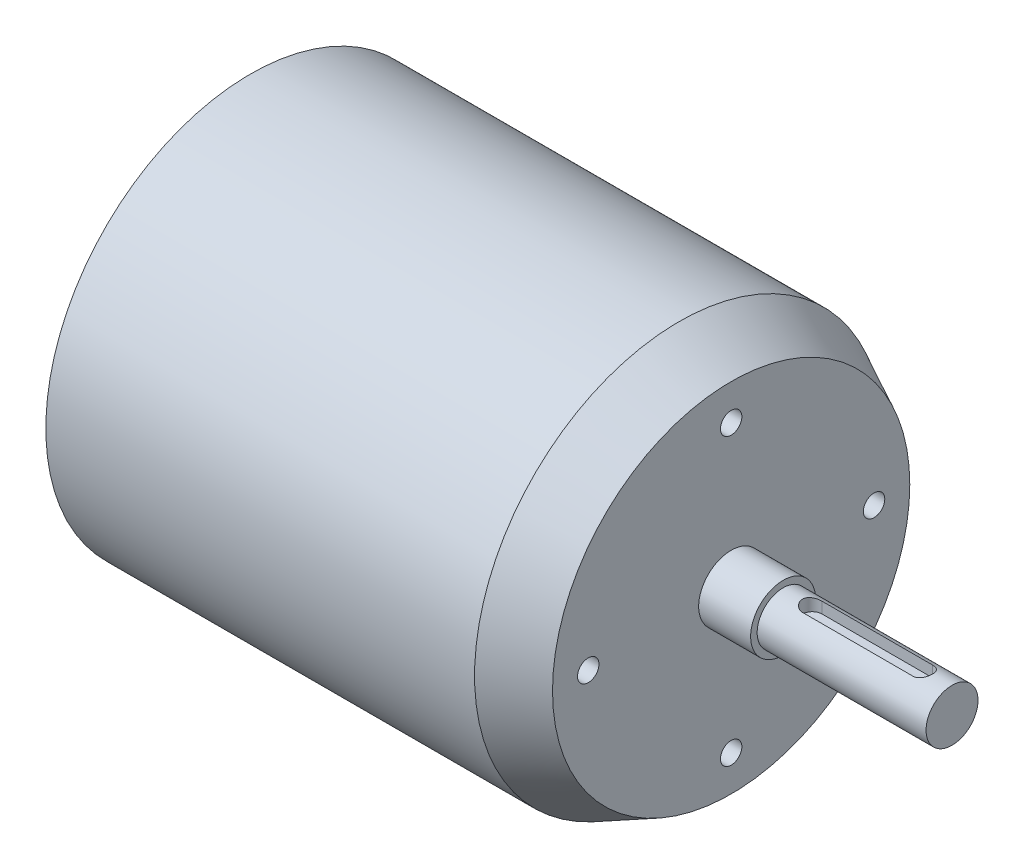
from build123d import *

# Parameters (mm, degrees)
SKETCH_1_R          = 31.5
EXTRUDE_1_DEPTH     = 74
SKETCH_2_R          = 5
EXTRUDE_2_DEPTH     = 8
SKETCH_3_R          = 4
EXTRUDE_3_DEPTH     = 26
CUT_EXTRUDE_1_DEPTH = 2
M4X0_7_1_D          = 3.3
M4X0_7_1_DEPTH      = 5.1
M4X0_7_1_TIP        = 0.991420021


with BuildPart() as part:
    # 草图1 → 凸台-拉伸1 (new body)
    with BuildSketch(Plane(origin=(0, 0, 0), x_dir=(0, 0, -1), z_dir=(1, 0, 0))):
        Circle(SKETCH_1_R)
    extrude(amount=-EXTRUDE_1_DEPTH)

    # 草图2 → 凸台-拉伸2 (add)
    with BuildSketch(Plane(origin=(0, 0, 0), x_dir=(0, 0, -1), z_dir=(1, 0, 0))):
        Circle(SKETCH_2_R)
    extrude(amount=EXTRUDE_2_DEPTH)

    # 草图3 → 凸台-拉伸3 (add)
    with BuildSketch(Plane(origin=(8, 0, 0), x_dir=(0, 0, -1), z_dir=(1, 0, 0))):
        with Locations(Location((0, 0, 0), (0, 0, 180))):
            Circle(SKETCH_3_R)
    extrude(amount=EXTRUDE_3_DEPTH)

    # Sketch 3D_1 → 切除-拉伸1 (cut)
    with BuildSketch(Plane(origin=(12.5, 4, 1.5), x_dir=(0.9847835588179368, 0, -0.17378533390904766), z_dir=(0, -1, 0))):
        with BuildLine():
            Line((0, 0), (16.7413205, 2.954350676))
            ThreePointArc((16.7413205, 2.954350676), (18.479173839, 1.737853339), (17.262676502, 0))
            Line((17.262676502, 0), (0.521356002, -2.954350676))
            ThreePointArc((0.521356002, -2.954350676), (-1.216497337, -1.737853339), (0, 0))
        make_face()
    extrude(amount=CUT_EXTRUDE_1_DEPTH, mode=Mode.SUBTRACT)

    # M4x0.7 螺纹孔1
    with Locations(Plane(origin=(0, 22, 0), x_dir=(0, 0, 1), z_dir=(1, 0, 0))):
        with Locations((0, 0), (-22, 22), (0, 44), (22, 22)):
            Hole(M4X0_7_1_D / 2, depth=M4X0_7_1_DEPTH)
            with Locations((0, 0, -(M4X0_7_1_DEPTH + M4X0_7_1_TIP / 2))):  # 118° drill point
                Cone(0, M4X0_7_1_D / 2, M4X0_7_1_TIP, mode=Mode.SUBTRACT)

    # 草图9 → 切除-旋转1 (revolve, cut)
    with BuildSketch(Plane.XY, mode=Mode.PRIVATE) as cut_revolve_1_sk:
        Polygon((0, 31.5), (0, 27.5), (-8, 31.5), align=None)
    revolve(cut_revolve_1_sk.sketch.rotate(Axis((0, 0, 0), (-1, 0, 0)), 90), axis=Axis((0, 0, 0), (-1, 0, 0)), mode=Mode.SUBTRACT)


solid = part.part
